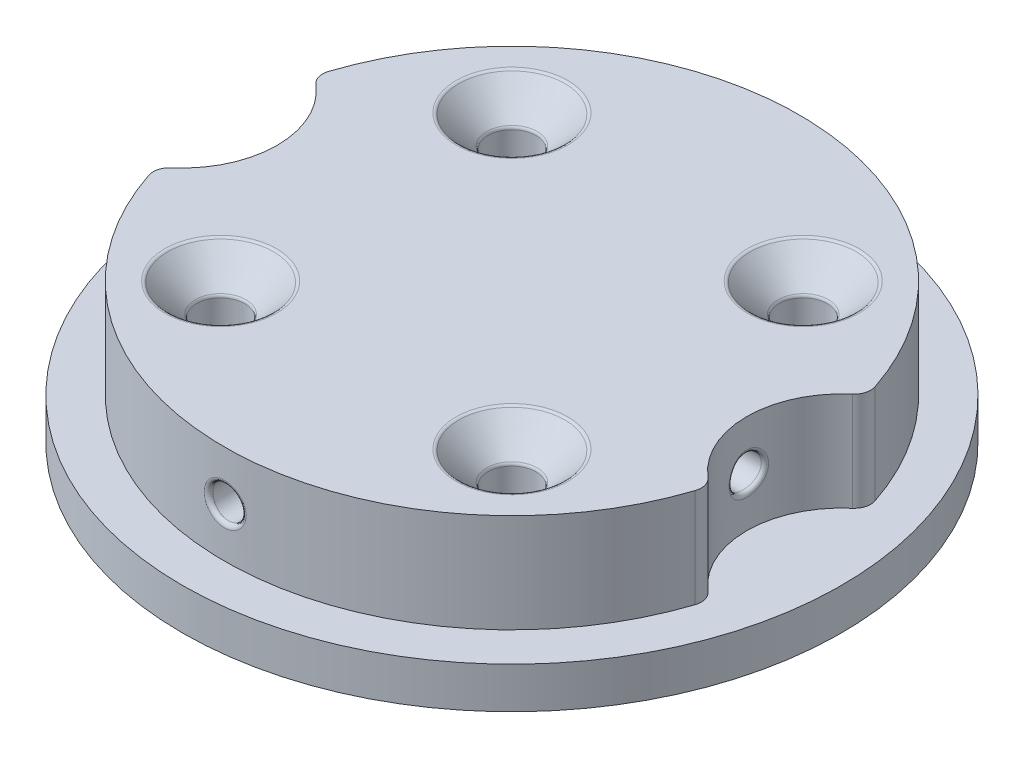
from build123d import *

# Parameters (mm, degrees)
SKETCH1_R           = 40
BOSS_EXTRUDE1_DEPTH = 5
BOSS_EXTRUDE2_DEPTH = 12
SKETCH3_R           = 2.93
CUT_EXTRUDE1_DEPTH  = 60.067757702
SKETCH5_R           = 2.93
SKETCH4_R           = 6.58
CIRPATTERN1_COUNT   = 4
CUT_EXTRUDE3_START  = 20
SKETCH9_R           = 2
CUT_EXTRUDE3_DEPTH  = 40.067757731
CIRPATTERN2_COUNT   = 4
FILLET2_R           = 0.5
FILLET4_R           = 2


with BuildPart() as part:
    # Sketch1 → Boss-Extrude1 (new body)
    with BuildSketch(Plane(origin=(0, 0, 0), x_dir=(1, 0, 0), z_dir=(0, 1, 0))):
        with Locations(Location((0, 0, 0), (0, 0, 270))):
            Circle(SKETCH1_R)
    extrude(amount=BOSS_EXTRUDE1_DEPTH)

    # Sketch2 → Boss-Extrude2 (add)
    with BuildSketch(Plane(origin=(0, 5, 0), x_dir=(1, 0, 0), z_dir=(0, 1, 0))):
        with BuildLine():
            ThreePointArc((-33.572, -9.535765098), (0, -34.9), (33.572, -9.535765098))
            ThreePointArc((33.572, -9.535765098), (28.5, 0), (33.572, 9.535765098))
            ThreePointArc((33.572, 9.535765098), (0, 34.9), (-33.572, 9.535765098))
            ThreePointArc((-33.572, 9.535765098), (-28.5, 0), (-33.572, -9.535765098))
        make_face()
    extrude(amount=BOSS_EXTRUDE2_DEPTH)

    # Sketch3 → Cut-Extrude1 (cut, through all)
    with BuildSketch(Plane(origin=(0, 17, 0), x_dir=(1, 0, 0), z_dir=(0, 1, 0))):
        with Locations(Location((-17.67766953, 17.67766953, 0), (0, 0, 270))):
            Circle(SKETCH3_R)
        with Locations(Location((17.67766953, 17.67766953, 0), (0, 0, 270))):
            Circle(SKETCH3_R)
        with Locations(Location((17.67766953, -17.67766953, 0), (0, 0, 270))):
            Circle(SKETCH3_R)
        with Locations(Location((-17.67766953, -17.67766953, 0), (0, 0, 270))):
            Circle(SKETCH3_R)
    extrude(amount=-CUT_EXTRUDE1_DEPTH, mode=Mode.SUBTRACT)

    # Sketch5 → Cut-Loft1 section 0
    with BuildSketch(Plane(origin=(0, 13.35, 0), x_dir=(1, 0, 0), z_dir=(0, 1, 0))):
        with Locations((-17.67766953, 17.67766953)):
            Circle(SKETCH5_R)
    # Sketch4 → Cut-Loft1 section 1
    with BuildSketch(Plane(origin=(0, 17, 0), x_dir=(1, 0, 0), z_dir=(0, 1, 0))):
        with Locations((-17.67766953, 17.67766953)):
            Circle(SKETCH4_R)
    cut_loft1 = loft(mode=Mode.SUBTRACT)

    # CirPattern1: Cut-Loft1 ×4 about axis
    cirpattern1_axis = Axis((0, 0, 0), (0, 1, 0))
    for i in range(1, CIRPATTERN1_COUNT):
        add(cut_loft1.rotate(cirpattern1_axis, i * 360 / CIRPATTERN1_COUNT), mode=Mode.SUBTRACT)

    # Sketch9 → Cut-Extrude3 (cut, through all)
    with BuildSketch(Plane.XY.offset(CUT_EXTRUDE3_START)):
        with Locations(Location((0, 11, 0), (0, 0, 180))):
            Circle(SKETCH9_R)
    cut_extrude3 = extrude(amount=CUT_EXTRUDE3_DEPTH, mode=Mode.SUBTRACT)

    # CirPattern2: Cut-Extrude3 ×4 about axis
    cirpattern2_axis = Axis((0, 0, 0), (0, 1, 0))
    for i in range(1, CIRPATTERN2_COUNT):
        add(cut_extrude3.rotate(cirpattern2_axis, i * 360 / CIRPATTERN2_COUNT), mode=Mode.SUBTRACT)

    # Fillet2
    fillet2_edges = [part.edges().sort_by_distance(p)[0] for p in [
        (-17.67766953, 0, 14.74766953),
        (17.67766953, 0, 14.74766953),
        (17.67766953, 0, -20.60766953),
        (-17.67766953, 0, -20.60766953),
        (-24.25766953, 17, -17.67766953),
        (-15.605846661, 13.35, -15.605846661),
        (-17.67766953, 17, 24.25766953),
        (-14.74766953, 13.35, 17.67766953),
        (24.25766953, 17, 17.67766953),
        (19.749492399, 13.35, 15.605846661),
        (17.67766953, 17, -24.25766953),
        (17.67766953, 13.35, -20.60766953),
        (2, 10.999999998, 34.842646284),
        (28.67524835, 10.999999999, -2.000000023),
        (-2, 10.999999998, -34.842646284),
        (-28.67524835, 10.999999999, 2.000000023),
    ]]
    fillet(fillet2_edges, radius=FILLET2_R)

    # Fillet4
    fillet4_edges = [part.edges().sort_by_distance(p)[0] for p in [
        (33.572, 11, 9.535765098),
        (33.572, 11, -9.535765098),
        (-33.572, 11, -9.535765098),
        (-33.572, 11, 9.535765098),
    ]]
    fillet(fillet4_edges, radius=FILLET4_R)


solid = part.part
